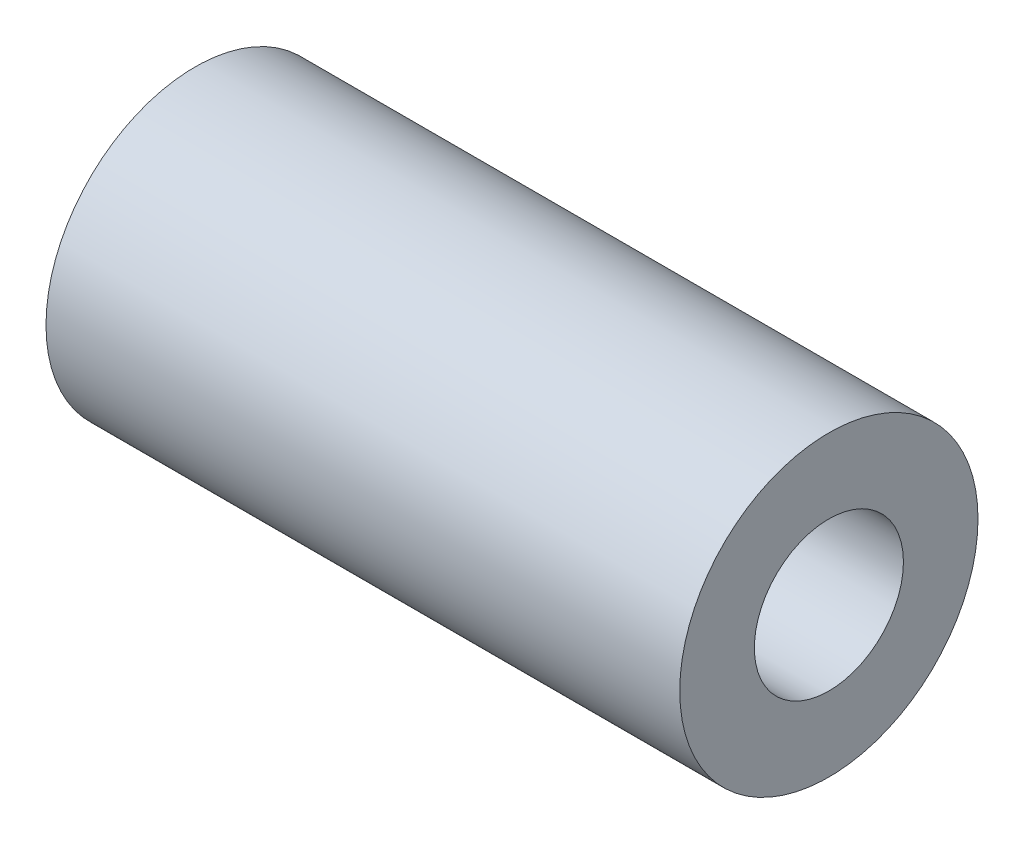
from build123d import *

# Parameters (mm, degrees)
SKETCH1_R           = 6.35
SKETCH1_R_2         = 3.175
BOSS_EXTRUDE1_DEPTH = 26.9875


with BuildPart() as part:
    # Sketch1 → Boss-Extrude1 (new body)
    with BuildSketch(Plane(origin=(0, 0, 0), x_dir=(0, 0, -1), z_dir=(1, 0, 0))):
        Circle(SKETCH1_R)
        Circle(SKETCH1_R_2, mode=Mode.SUBTRACT)
    extrude(amount=BOSS_EXTRUDE1_DEPTH)


solid = part.part
